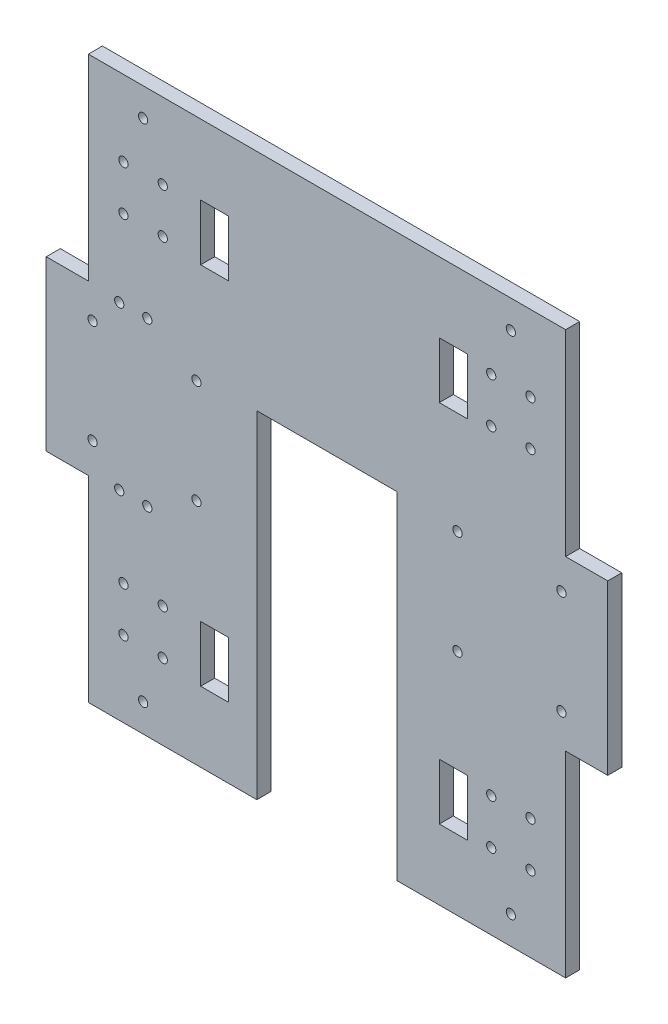
from build123d import *

# Parameters (mm, degrees)
MODEL_R         = 1.65
EXTRUDE_1_DEPTH = 5


with BuildPart() as part:
    # Model → 凸台-拉伸1 (new body)
    with BuildSketch(Plane.XY):
        Polygon((202.712050333, 317.514034213), (372.712050333, 317.514034213), (372.712050333, 247.514034213), (387.712050333, 247.514034213), (387.712050333, 187.514034213), (372.712050333, 187.514034213), (372.712050333, 117.514034213), (312.712050333, 117.514034213), (312.712050333, 237.514034213), (262.712050333, 237.514034213), (262.712050333, 117.514034213), (202.712050333, 117.514034213), (202.712050333, 187.514034213), (187.712050333, 187.514034213), (187.712050333, 247.514034213), (202.712050333, 247.514034213), align=None)
        with Locations((204.212050333, 236.014034213)):
            Circle(MODEL_R, mode=Mode.SUBTRACT)
        with Locations((222.212050333, 127.514034213)):
            Circle(MODEL_R, mode=Mode.SUBTRACT)
        with Locations((353.212050333, 127.514034213)):
            Circle(MODEL_R, mode=Mode.SUBTRACT)
        with Locations((222.212050333, 307.514034213)):
            Circle(MODEL_R, mode=Mode.SUBTRACT)
        with Locations((353.212050333, 307.514034213)):
            Circle(MODEL_R, mode=Mode.SUBTRACT)
        with Locations((241.212050333, 236.014034213)):
            Circle(MODEL_R, mode=Mode.SUBTRACT)
        with Locations((204.212050333, 199.014034213)):
            Circle(MODEL_R, mode=Mode.SUBTRACT)
        with Locations((241.212050333, 199.014034213)):
            Circle(MODEL_R, mode=Mode.SUBTRACT)
        with Locations((371.212050333, 236.014034213)):
            Circle(MODEL_R, mode=Mode.SUBTRACT)
        with Locations((334.212050333, 236.014034213)):
            Circle(MODEL_R, mode=Mode.SUBTRACT)
        with Locations((371.212050333, 199.014034213)):
            Circle(MODEL_R, mode=Mode.SUBTRACT)
        with Locations((334.212050333, 199.014034213)):
            Circle(MODEL_R, mode=Mode.SUBTRACT)
        with Locations((215.212050333, 290.514034213)):
            Circle(MODEL_R, mode=Mode.SUBTRACT)
        with Locations((229.212050333, 290.514034213)):
            Circle(MODEL_R, mode=Mode.SUBTRACT)
        with Locations((215.212050333, 274.514034213)):
            Circle(MODEL_R, mode=Mode.SUBTRACT)
        with Locations((229.212050333, 274.514034213)):
            Circle(MODEL_R, mode=Mode.SUBTRACT)
        with Locations((215.212050333, 144.514034213)):
            Circle(MODEL_R, mode=Mode.SUBTRACT)
        with Locations((215.212050333, 160.514034213)):
            Circle(MODEL_R, mode=Mode.SUBTRACT)
        with Locations((360.212050333, 290.514034213)):
            Circle(MODEL_R, mode=Mode.SUBTRACT)
        with Locations((346.212050333, 290.514034213)):
            Circle(MODEL_R, mode=Mode.SUBTRACT)
        with Locations((360.212050333, 274.514034213)):
            Circle(MODEL_R, mode=Mode.SUBTRACT)
        with Locations((346.212050333, 274.514034213)):
            Circle(MODEL_R, mode=Mode.SUBTRACT)
        with Locations((360.212050333, 144.514034213)):
            Circle(MODEL_R, mode=Mode.SUBTRACT)
        with Locations((360.212050333, 160.514034213)):
            Circle(MODEL_R, mode=Mode.SUBTRACT)
        with Locations((229.212050333, 144.514034213)):
            Circle(MODEL_R, mode=Mode.SUBTRACT)
        with Locations((229.212050333, 160.514034213)):
            Circle(MODEL_R, mode=Mode.SUBTRACT)
        with Locations((346.212050333, 144.514034213)):
            Circle(MODEL_R, mode=Mode.SUBTRACT)
        with Locations((346.212050333, 160.514034213)):
            Circle(MODEL_R, mode=Mode.SUBTRACT)
        with Locations((223.712050333, 246.514034213)):
            Circle(MODEL_R, mode=Mode.SUBTRACT)
        with Locations((213.712050333, 246.442167925)):
            Circle(MODEL_R, mode=Mode.SUBTRACT)
        with Locations((223.712050333, 188.514034213)):
            Circle(MODEL_R, mode=Mode.SUBTRACT)
        with Locations((213.712050333, 188.585900501)):
            Circle(MODEL_R, mode=Mode.SUBTRACT)
        Polygon((252.712050333, 142.514034213), (247.712050333, 142.514034213), (242.712050333, 142.514034213), (242.712050333, 162.514034213), (252.712050333, 162.514034213), align=None, mode=Mode.SUBTRACT)
        Polygon((327.712050333, 142.514034213), (332.712050333, 142.514034213), (337.712050333, 142.514034213), (337.712050333, 162.514034213), (327.712050333, 162.514034213), align=None, mode=Mode.SUBTRACT)
        Polygon((252.712050333, 292.514034213), (247.712050333, 292.514034213), (242.712050333, 292.514034213), (242.712050333, 272.514034213), (252.712050333, 272.514034213), align=None, mode=Mode.SUBTRACT)
        Polygon((327.712050333, 292.514034213), (332.712050333, 292.514034213), (337.712050333, 292.514034213), (337.712050333, 272.514034213), (327.712050333, 272.514034213), align=None, mode=Mode.SUBTRACT)
    extrude(amount=EXTRUDE_1_DEPTH)


solid = part.part
